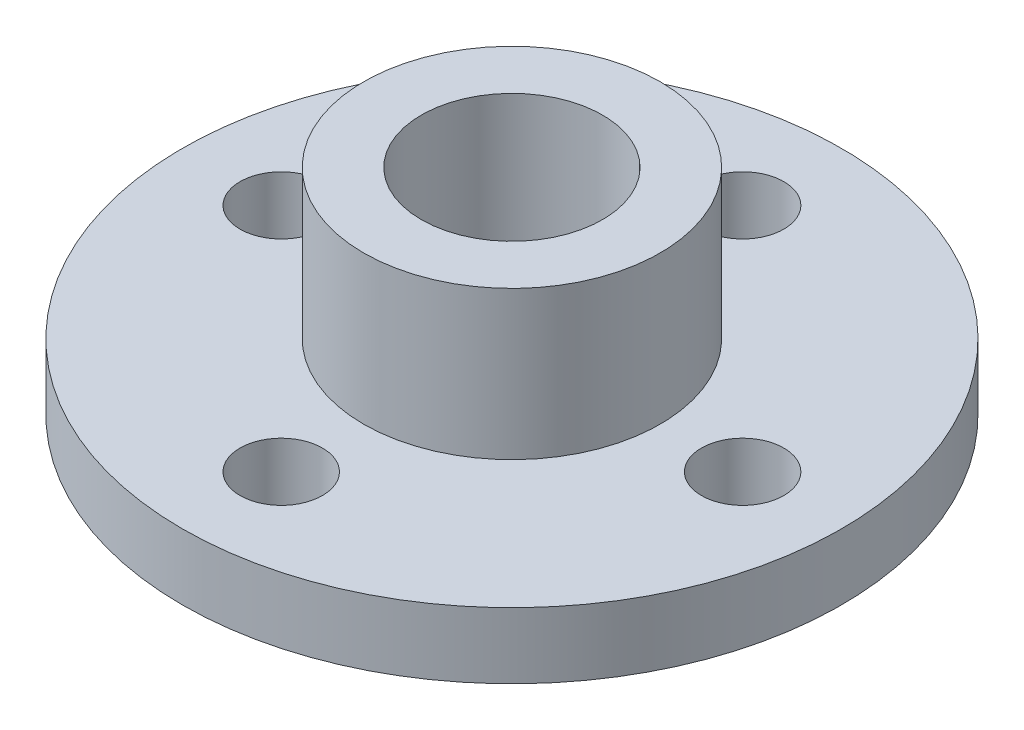
from build123d import *

# Parameters (mm, degrees)
SKETCH2_R           = 10
BOSS_EXTRUDE1_DEPTH = 2
SKETCH2_3_R         = 4.5
SKETCH2_3_R_2       = 2.75
BOSS_EXTRUDE2_DEPTH = 4.5
CIRPATTERN1_COUNT   = 4


with BuildPart() as part:
    # Sketch2 → Boss-Extrude1 (new body)
    with BuildSketch(Plane(origin=(0, 0, 0), x_dir=(1, 0, 0), z_dir=(0, 1, 0))):
        Circle(SKETCH2_R)
    extrude(amount=-BOSS_EXTRUDE1_DEPTH)

    # Sketch2<3> → Boss-Extrude2 (add)
    with BuildSketch(Plane(origin=(0, 0, 0), x_dir=(1, 0, 0), z_dir=(0, 1, 0))):
        Circle(SKETCH2_3_R)
        Circle(SKETCH2_3_R_2, mode=Mode.SUBTRACT)
    extrude(amount=BOSS_EXTRUDE2_DEPTH)

    # Sketch5 → Tap Drill for M3x0.5 Tap1 (revolve, cut)
    with BuildSketch(Plane(origin=(0, 0, -7), x_dir=(0, 0, 1), z_dir=(1, 0, 0))):
        Polygon((0, 0), (0, 10.911075774), (1.25, 10.16), (1.25, 0), align=None)
    tap_drill_for_m3x0_5_tap1 = revolve(axis=Axis((0, 6.35, -7), (0, -1, 0)), mode=Mode.SUBTRACT)

    # CirPattern1: Tap Drill for M3x0.5 Tap1 ×4 about axis
    cirpattern1_axis = Axis((0, -2, 0), (0, 1, 0))
    for i in range(1, CIRPATTERN1_COUNT):
        add(tap_drill_for_m3x0_5_tap1.rotate(cirpattern1_axis, i * 360 / CIRPATTERN1_COUNT), mode=Mode.SUBTRACT)


solid = part.part
